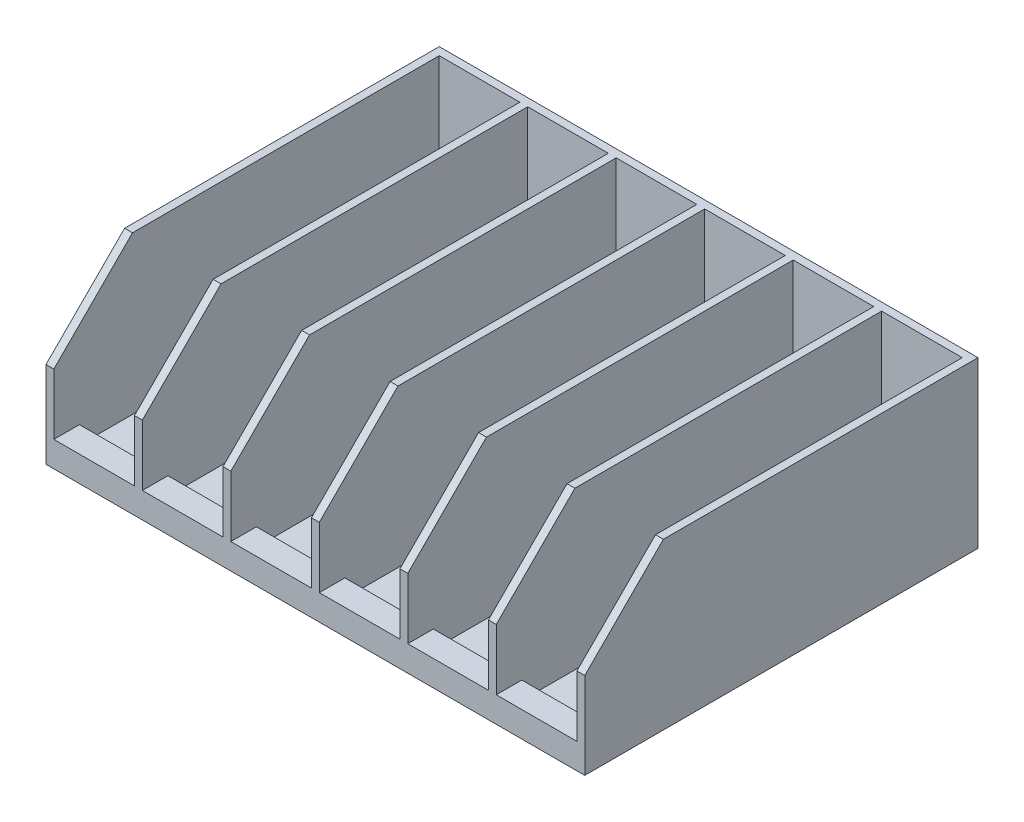
from build123d import *

# Parameters (mm, degrees)
SKETCH1_W            = 137
SKETCH1_H            = 100
BOSS_EXTRUDE1_DEPTH  = 2
BOSS_EXTRUDE2_DEPTH  = 2
SKETCH4_W            = 135
SKETCH4_H            = 40
BOSS_EXTRUDE3_DEPTH  = 2
BOSS_EXTRUDE6_START  = -22.5
BOSS_EXTRUDE6_DEPTH  = 2
BOSS_EXTRUDE7_START  = -45
BOSS_EXTRUDE7_DEPTH  = 2
BOSS_EXTRUDE8_START  = -67.5
BOSS_EXTRUDE8_DEPTH  = 2
BOSS_EXTRUDE9_START  = -90
BOSS_EXTRUDE9_DEPTH  = 2
BOSS_EXTRUDE10_START = -112.5
BOSS_EXTRUDE10_DEPTH = 2
BOSS_EXTRUDE11_START = -135
BOSS_EXTRUDE11_DEPTH = 2
BOSS_EXTRUDE12_DEPTH = 133


with BuildPart() as part:
    # Sketch1 → Boss-Extrude1 (new body)
    with BuildSketch(Plane(origin=(0, 0, 0), x_dir=(1, 0, 0), z_dir=(0, 1, 0))):
        with Locations((68.5, 50)):
            Rectangle(SKETCH1_W, SKETCH1_H)
    extrude(amount=BOSS_EXTRUDE1_DEPTH)

    # Sketch3 → Boss-Extrude2 (add)
    with BuildSketch(Plane.ZY):
        Polygon((-100, 2), (-100, 42), (-20, 42), (0, 22), (0, 2), align=None)
    extrude(amount=-BOSS_EXTRUDE2_DEPTH)

    # Sketch4 → Boss-Extrude3 (add)
    with BuildSketch(Plane(origin=(0, 0, -100), x_dir=(-1, 0, 0), z_dir=(0, 0, -1))):
        with Locations((-69.5, 22)):
            Rectangle(SKETCH4_W, SKETCH4_H)
    extrude(amount=-BOSS_EXTRUDE3_DEPTH)

    # Sketch3<5> → Boss-Extrude6 (add)
    with BuildSketch(Plane.ZY.offset(BOSS_EXTRUDE6_START)):
        Polygon((-100, 2), (-100, 42), (-20, 42), (0, 22), (0, 2), align=None)
    extrude(amount=-BOSS_EXTRUDE6_DEPTH)

    # Sketch3<6> → Boss-Extrude7 (add)
    with BuildSketch(Plane.ZY.offset(BOSS_EXTRUDE7_START)):
        Polygon((-100, 2), (-100, 42), (-20, 42), (0, 22), (0, 2), align=None)
    extrude(amount=-BOSS_EXTRUDE7_DEPTH)

    # Sketch3<7> → Boss-Extrude8 (add)
    with BuildSketch(Plane.ZY.offset(BOSS_EXTRUDE8_START)):
        Polygon((-100, 2), (-100, 42), (-20, 42), (0, 22), (0, 2), align=None)
    extrude(amount=-BOSS_EXTRUDE8_DEPTH)

    # Sketch3<8> → Boss-Extrude9 (add)
    with BuildSketch(Plane.ZY.offset(BOSS_EXTRUDE9_START)):
        Polygon((-100, 2), (-100, 42), (-20, 42), (0, 22), (0, 2), align=None)
    extrude(amount=-BOSS_EXTRUDE9_DEPTH)

    # Sketch3<9> → Boss-Extrude10 (add)
    with BuildSketch(Plane.ZY.offset(BOSS_EXTRUDE10_START)):
        Polygon((-100, 2), (-100, 42), (-20, 42), (0, 22), (0, 2), align=None)
    extrude(amount=-BOSS_EXTRUDE10_DEPTH)

    # Sketch3<10> → Boss-Extrude11 (add)
    with BuildSketch(Plane.ZY.offset(BOSS_EXTRUDE11_START)):
        Polygon((-100, 2), (-100, 42), (-20, 42), (0, 22), (0, 2), align=None)
    extrude(amount=-BOSS_EXTRUDE11_DEPTH)

    # Sketch5 → Boss-Extrude12 (add)
    with BuildSketch(Plane(origin=(2, 0, 0), x_dir=(0, 0, -1), z_dir=(1, 0, 0))):
        Polygon((0, 2), (0, 6.5), (6.5, 6.5), (11, 2), align=None)
    extrude(amount=BOSS_EXTRUDE12_DEPTH)


solid = part.part
